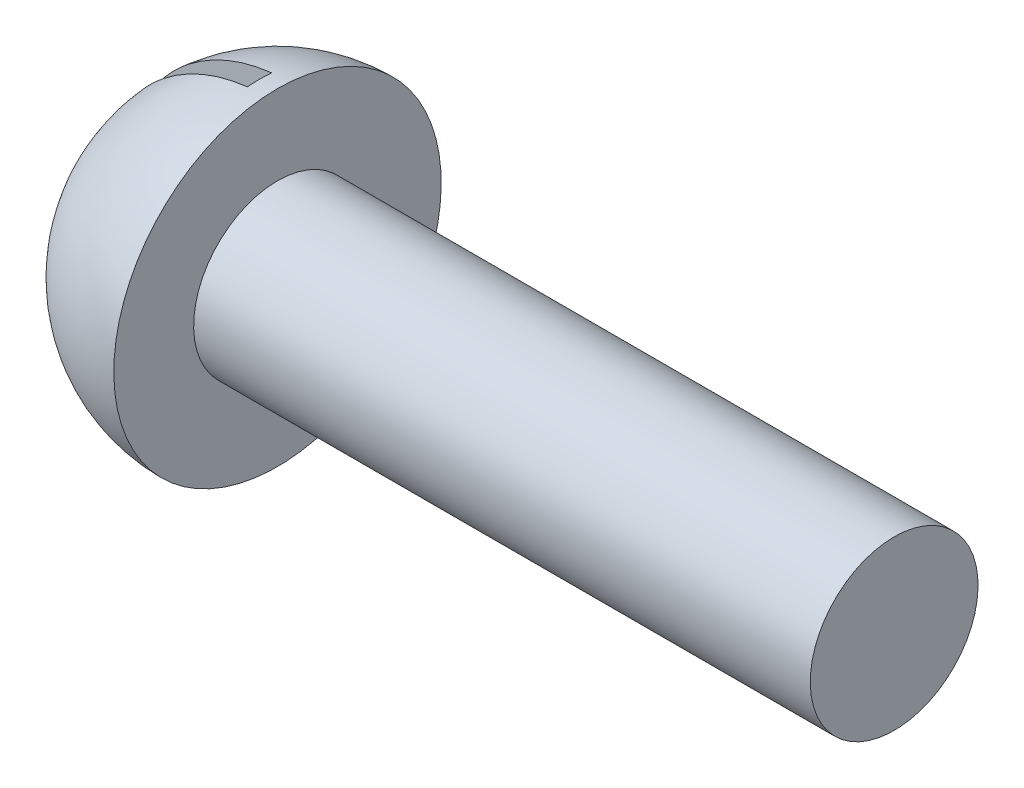
from build123d import *

# Parameters (mm, degrees)
SKETCH2_W          = 0.5
SKETCH2_H          = 8.749412665
CUT_EXTRUDE1_DEPTH = 3


with BuildPart() as part:
    # Sketch1 → Revolve3 (revolve)
    with BuildSketch(Plane.XY):
        with BuildLine():
            Line((12.7, 0), (12.7, 1.7272))
            Line((12.7, 1.7272), (0, 1.7272))
            Line((0, 1.7272), (0, 3.371476925))
            ThreePointArc((0, 3.371476925), (-2.383994197, 2.383994197), (-3.371476925, 0))
            Line((-3.371476925, 0), (12.7, 0))
        make_face()
    revolve(axis=Axis((58.216447622, 0, 0), (-1, 0, 0)))

    # Sketch2 → Cut-Extrude1 (cut)
    with BuildSketch(Plane.ZY.offset(3.371476925)):
        with Locations((0, -0.032949338)):
            Rectangle(SKETCH2_W, SKETCH2_H)
    extrude(amount=-CUT_EXTRUDE1_DEPTH, mode=Mode.SUBTRACT)


solid = part.part
